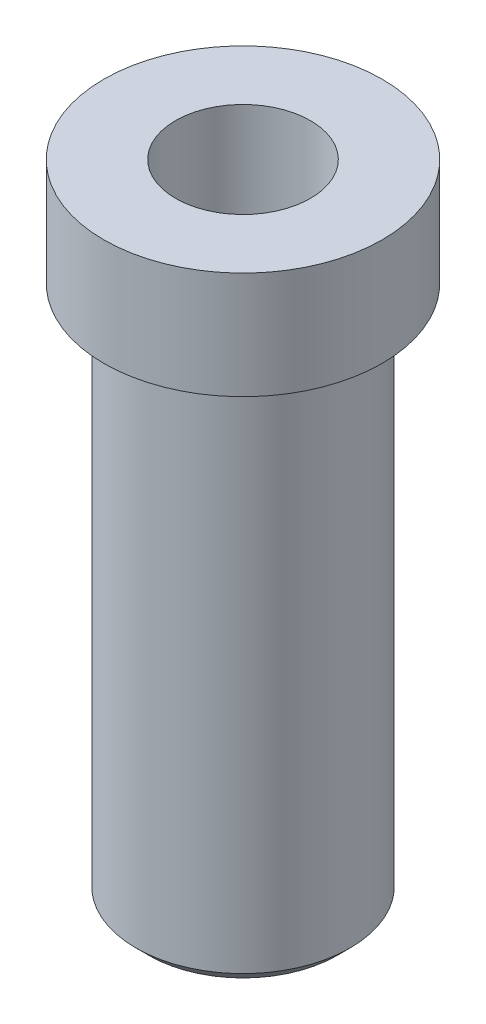
from build123d import *

# Parameters (mm, degrees)
CHAMFER1_SIZE = 1.524


with BuildPart() as part:
    # Sketch1 → Revolve2 (revolve)
    with BuildSketch(Plane.XY, mode=Mode.PRIVATE) as revolve2_sk:
        Polygon((12.7, -38.1), (12.7, 25.4), (16.51, 25.4), (16.51, 38.1), (8.001, 38.1), (8.001, -38.1), align=None)
    revolve(revolve2_sk.sketch.rotate(Axis((0, 38.1, 0), (0, -1, 0)), 180), axis=Axis((0, 38.1, 0), (0, -1, 0)))

    # Chamfer1
    chamfer1_edges = [part.edges().sort_by_distance(p)[0] for p in [
        (12.7, -38.1, 0),
    ]]
    chamfer(chamfer1_edges, length=CHAMFER1_SIZE)


solid = part.part
